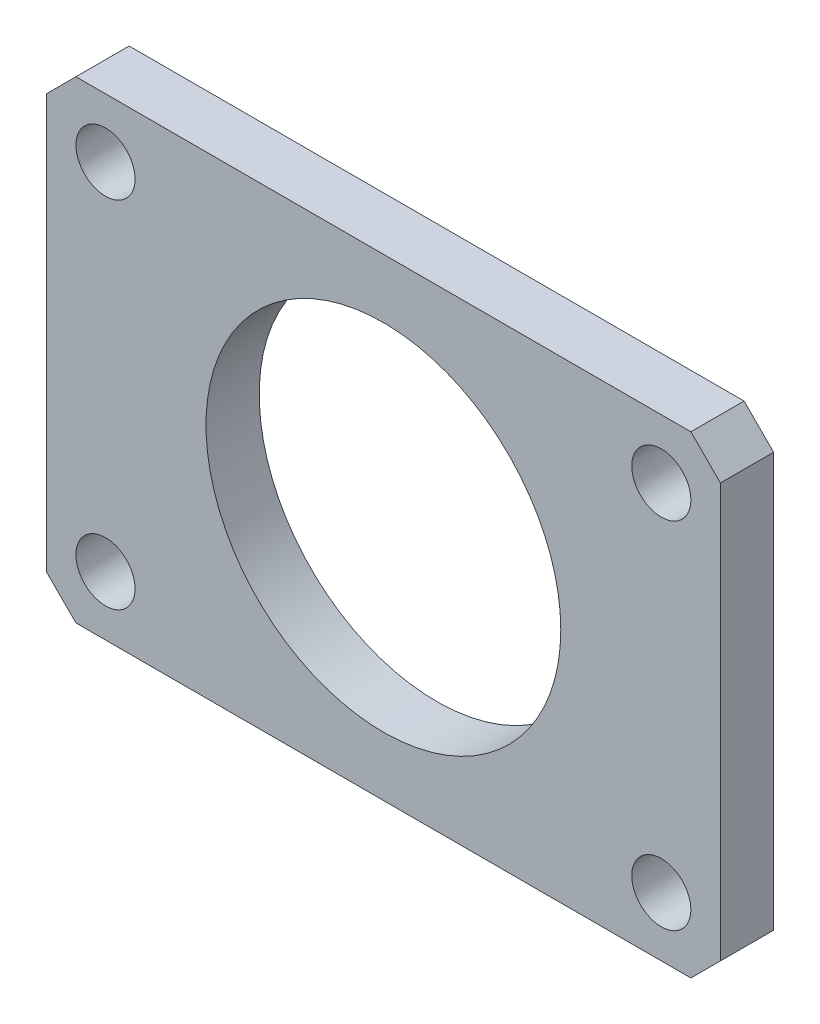
from build123d import *

# Parameters (mm, degrees)
SKETCH_1_W          = 28.5
SKETCH_1_H          = 20
SKETCH_1_R          = 2.5
EXTRUDE_1_DEPTH     = 4.5
CHAMFER_1_SIZE      = 2.5
SKETCH_2_R          = 15
CUT_EXTRUDE_1_DEPTH = 53.419581265


with BuildPart() as part:
    # Эскиз1 → Бобышка-Вытянуть1 (new body)
    with BuildSketch(Plane.XY):
        Rectangle(SKETCH_1_W, SKETCH_1_H)
        with Locations((9.25, 5)):
            Circle(SKETCH_1_R, mode=Mode.SUBTRACT)
    extrude(amount=EXTRUDE_1_DEPTH)

    # Фаска1
    chamfer_1_edges = [part.edges().sort_by_distance(p)[0] for p in [
        (14.25, 10, 2.25),
    ]]
    chamfer(chamfer_1_edges, length=CHAMFER_1_SIZE)

    # Зеркальное отражение1: part across plane


with BuildPart() as part_1:
    add(part.part)
    add(part.part.mirror(Plane(origin=(-14.25, -10, 4.5), x_dir=(0, 0, 1), z_dir=(0, 1, 0))))

    # Зеркальное отражение2: part across plane


with BuildPart() as part_2:
    add(part_1.part)
    add(part_1.part.mirror(Plane(origin=(-14.25, -10, 4.5), x_dir=(0, 0, 1), z_dir=(1, 0, 0))))

    # Эскиз2 → Вырез-Вытянуть1 (cut, through all)
    with BuildSketch(Plane.XY.offset(4.5)):
        with Locations((-14.25, -10)):
            Circle(SKETCH_2_R)
    extrude(amount=-CUT_EXTRUDE_1_DEPTH, mode=Mode.SUBTRACT)


solid = part_2.part
